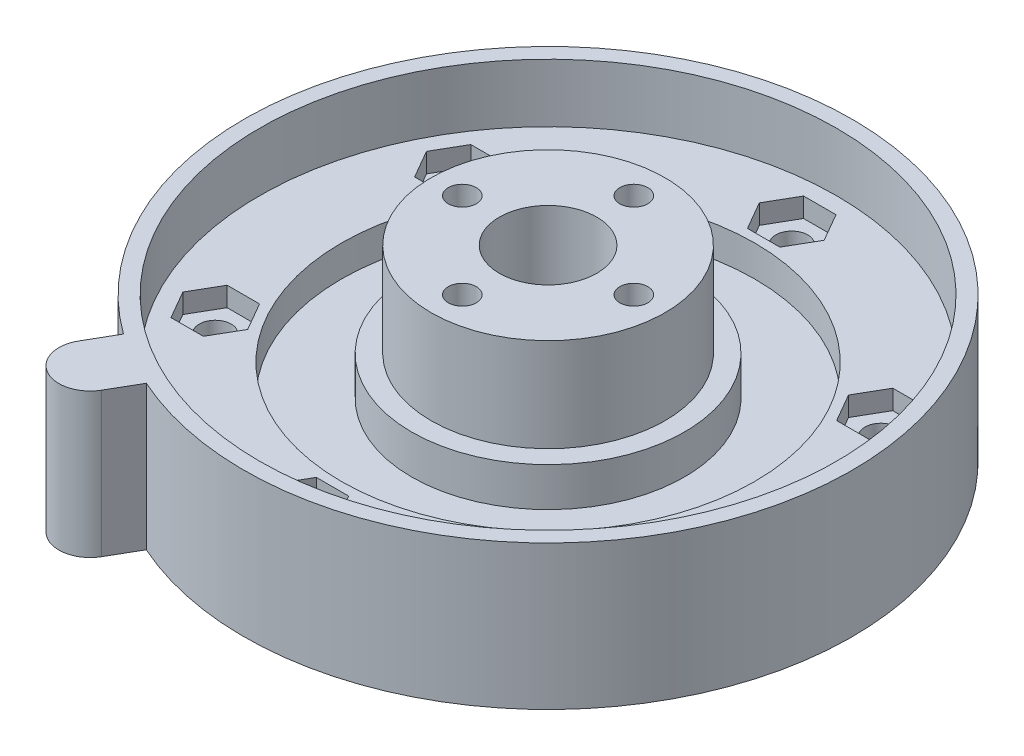
from build123d import *

# Parameters (mm, degrees)
SKETCH1_R                                           = 39
BOSS_EXTRUDE1_DEPTH                                 = 18.5
SKETCH2_R                                           = 37
CUT_EXTRUDE1_DEPTH                                  = 7.5
SKETCH3_R                                           = 26.5
CUT_EXTRUDE2_DEPTH                                  = 4
SKETCH4_R                                           = 17.5
BOSS_EXTRUDE2_DEPTH                                 = 5
SKETCH5_R                                           = 15
BOSS_EXTRUDE3_DEPTH                                 = 12
SKETCH6_R                                           = 6.25
SKETCH6_R_2                                         = 1.8
CUT_EXTRUDE3_DEPTH                                  = 61.149812967
CSK_FOR_M4_COUNTERSUNK_FLAT_HEAD_SCREW1_D           = 3.5
CSK_FOR_M4_COUNTERSUNK_FLAT_HEAD_SCREW1_CSINK_D     = 9.1
CSK_FOR_M4_COUNTERSUNK_FLAT_HEAD_SCREW1_CSINK_ANGLE = 90
SKETCH9_R                                           = 2.05
CUT_EXTRUDE4_DEPTH                                  = 57.665686289
CUT_EXTRUDE5_DEPTH                                  = 2.5
CIRPATTERN1_COUNT                                   = 6
SKETCH11_R                                          = 4
BOSS_EXTRUDE5_DEPTH                                 = 18.5


with BuildPart() as part:
    # Sketch1 → Boss-Extrude1 (new body)
    with BuildSketch(Plane(origin=(0, 0, 0), x_dir=(1, 0, 0), z_dir=(0, 1, 0))):
        with Locations(Location((0, 0, 0), (0, 0, 270))):
            Circle(SKETCH1_R)
    extrude(amount=BOSS_EXTRUDE1_DEPTH)

    # Sketch2 → Cut-Extrude1 (cut)
    with BuildSketch(Plane(origin=(0, 18.5, 0), x_dir=(1, 0, 0), z_dir=(0, 1, 0))):
        with Locations(Location((0, 0, 0), (0, 0, 270))):
            Circle(SKETCH2_R)
    extrude(amount=-CUT_EXTRUDE1_DEPTH, mode=Mode.SUBTRACT)

    # Sketch3 → Cut-Extrude2 (cut)
    with BuildSketch(Plane(origin=(0, 11, 0), x_dir=(1, 0, 0), z_dir=(0, 1, 0))):
        with Locations(Location((0, 0, 0), (0, 0, 270))):
            Circle(SKETCH3_R)
    extrude(amount=-CUT_EXTRUDE2_DEPTH, mode=Mode.SUBTRACT)

    # Sketch4 → Boss-Extrude2 (add)
    with BuildSketch(Plane(origin=(0, 7, 0), x_dir=(1, 0, 0), z_dir=(0, 1, 0))):
        with Locations(Location((0, 0, 0), (0, 0, 270))):
            Circle(SKETCH4_R)
    extrude(amount=BOSS_EXTRUDE2_DEPTH)

    # Sketch5 → Boss-Extrude3 (add)
    with BuildSketch(Plane(origin=(0, 12, 0), x_dir=(1, 0, 0), z_dir=(0, 1, 0))):
        with Locations(Location((0, 0, 0), (0, 0, 270))):
            Circle(SKETCH5_R)
    extrude(amount=BOSS_EXTRUDE3_DEPTH)

    # Sketch6 → Cut-Extrude3 (cut, through all)
    with BuildSketch(Plane(origin=(0, 24, 0), x_dir=(1, 0, 0), z_dir=(0, 1, 0))):
        with Locations(Location((0, 0, 0), (0, 0, 270))):
            Circle(SKETCH6_R)
        with Locations(Location((0, 11, 0), (0, 0, 270))):
            Circle(SKETCH6_R_2)
        with Locations(Location((11, 0, 0), (0, 0, 270))):
            Circle(SKETCH6_R_2)
        with Locations(Location((0, -11, 0), (0, 0, 270))):
            Circle(SKETCH6_R_2)
        with Locations(Location((-11, 0, 0), (0, 0, 270))):
            Circle(SKETCH6_R_2)
    extrude(amount=-CUT_EXTRUDE3_DEPTH, mode=Mode.SUBTRACT)

    # CSK for M4 Countersunk Flat Head Screw1 (through all)
    with Locations(Plane(origin=(0, 0, 11), x_dir=(0, 0, -1), z_dir=(0, -1, 0))):
        with Locations((0, 0), (11, 11), (22, 0), (11, -11)):
            CounterSinkHole(CSK_FOR_M4_COUNTERSUNK_FLAT_HEAD_SCREW1_D / 2, CSK_FOR_M4_COUNTERSUNK_FLAT_HEAD_SCREW1_CSINK_D / 2, counter_sink_angle=CSK_FOR_M4_COUNTERSUNK_FLAT_HEAD_SCREW1_CSINK_ANGLE)

    # Sketch9 → Cut-Extrude4 (cut, through all)
    with BuildSketch(Plane(origin=(0, 11, 0), x_dir=(1, 0, 0), z_dir=(0, 1, 0))):
        with Locations(Location((0, 31.25, 0), (0, 0, 270))):
            Circle(SKETCH9_R)
        with Locations(Location((27.063293868, 15.625, 0), (0, 0, 270))):
            Circle(SKETCH9_R)
        with Locations(Location((27.063293868, -15.625, 0), (0, 0, 270))):
            Circle(SKETCH9_R)
        with Locations(Location((0, -31.25, 0), (0, 0, 270))):
            Circle(SKETCH9_R)
        with Locations(Location((-27.063293868, -15.625, 0), (0, 0, 270))):
            Circle(SKETCH9_R)
        with Locations(Location((-27.063293868, 15.625, 0), (0, 0, 270))):
            Circle(SKETCH9_R)
    extrude(amount=-CUT_EXTRUDE4_DEPTH, mode=Mode.SUBTRACT)

    # Sketch10 → Cut-Extrude5 (cut)
    with BuildSketch(Plane(origin=(0, 11, 0), x_dir=(1, 0, 0), z_dir=(0, 1, 0))):
        Polygon((2.078460969, 34.85), (-2.078460969, 34.85), (-4.156921938, 31.25), (-2.078460969, 27.65), (2.078460969, 27.65), (4.156921938, 31.25), align=None)
    cut_extrude5 = extrude(amount=-CUT_EXTRUDE5_DEPTH, mode=Mode.SUBTRACT)

    # CirPattern1: Cut-Extrude5 ×6 about axis
    cirpattern1_axis = Axis((0, 0, 0), (0, 1, 0))
    for i in range(1, CIRPATTERN1_COUNT):
        add(cut_extrude5.rotate(cirpattern1_axis, i * 360 / CIRPATTERN1_COUNT), mode=Mode.SUBTRACT)

    # Sketch11 → Boss-Extrude5 (add, through all)
    with BuildSketch(Plane(origin=(0, 18.5, 0), x_dir=(1, 0, 0), z_dir=(0, 1, 0))):
        with Locations((-21.5, -37.239092363)):
            Circle(SKETCH11_R)
        with BuildLine():
            ThreePointArc((-17.5, -37.239092363), (-17.636296695, -38.274368543), (-18.035898385, -39.239092363))
            Line((-18.035898385, -39.239092363), (-15.933063126, -35.596874855))
            ThreePointArc((-15.933063126, -35.596874855), (-17.739935267, -34.731753436), (-19.499999848, -33.774990835))
            ThreePointArc((-19.499999848, -33.774990835), (-18.035898341, -35.239092439), (-17.5, -37.239092363))
        make_face()
        with BuildLine():
            Line((-22.861266356, -31.596874855), (-24.964101615, -35.239092363))
            ThreePointArc((-24.964101615, -35.239092363), (-22.535276096, -33.375389035), (-19.499999848, -33.774990835))
            ThreePointArc((-19.499999848, -33.774990835), (-21.208613012, -32.729111416), (-22.861266356, -31.596874855))
        make_face()
    extrude(amount=-BOSS_EXTRUDE5_DEPTH)


solid = part.part
